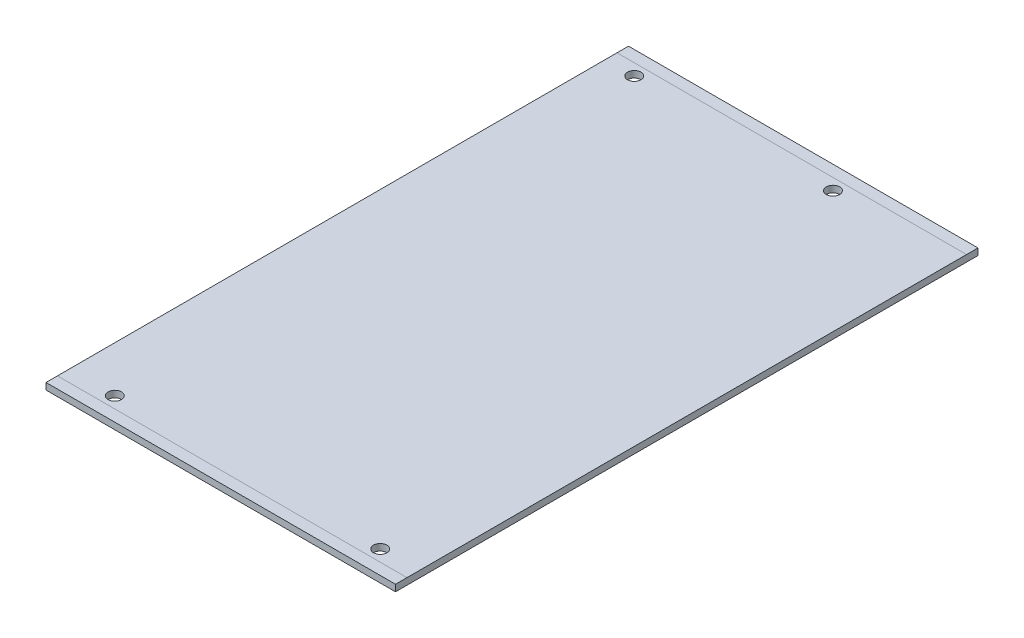
from build123d import *

# Parameters (mm, degrees)
SKETCH1_W           = 91.44
SKETCH1_H           = 152.4
BOSS_EXTRUDE1_DEPTH = 1.724
CUT_EXTRUDE1_REACH  = 90.88
SKETCH2_R           = 1.75
SKETCH3_W           = 91.44
SKETCH3_H           = 3
CUT_EXTRUDE2_DEPTH  = 0.0001


with BuildPart() as part:
    # Sketch1 → Boss-Extrude1 (new body)
    with BuildSketch(Plane(origin=(0, 0, 0), x_dir=(1, 0, 0), z_dir=(0, 1, 0))):
        Rectangle(SKETCH1_W, SKETCH1_H)
    extrude(amount=BOSS_EXTRUDE1_DEPTH)

    # Sketch2 → Cut-Extrude1 (cut, up to next)
    with BuildSketch(Plane(origin=(0, 1.724, 0), x_dir=(1, 0, 0), z_dir=(0, 1, 0)), mode=Mode.PRIVATE) as cut_extrude1_sk1:
        with Locations(Location((-38.22, 70.2, 0), (0, 0, 270))):
            Circle(SKETCH2_R)
    cut_extrude1_tool1 = extrude(cut_extrude1_sk1.sketch, amount=-CUT_EXTRUDE1_REACH, mode=Mode.PRIVATE) & part.part
    # Sketch2 → Cut-Extrude1 (cut, up to next)
    with BuildSketch(Plane(origin=(0, 1.724, 0), x_dir=(1, 0, 0), z_dir=(0, 1, 0)), mode=Mode.PRIVATE) as cut_extrude1_sk2:
        with Locations(Location((-33.72, -70.2, 0), (0, 0, 270))):
            Circle(SKETCH2_R)
    cut_extrude1_tool2 = extrude(cut_extrude1_sk2.sketch, amount=-CUT_EXTRUDE1_REACH, mode=Mode.PRIVATE) & part.part
    # Sketch2 → Cut-Extrude1 (cut, up to next)
    with BuildSketch(Plane(origin=(0, 1.724, 0), x_dir=(1, 0, 0), z_dir=(0, 1, 0)), mode=Mode.PRIVATE) as cut_extrude1_sk3:
        with Locations(Location((35.72, -70.2, 0), (0, 0, 270))):
            Circle(SKETCH2_R)
    cut_extrude1_tool3 = extrude(cut_extrude1_sk3.sketch, amount=-CUT_EXTRUDE1_REACH, mode=Mode.PRIVATE) & part.part
    # Sketch2 → Cut-Extrude1 (cut, up to next)
    with BuildSketch(Plane(origin=(0, 1.724, 0), x_dir=(1, 0, 0), z_dir=(0, 1, 0)), mode=Mode.PRIVATE) as cut_extrude1_sk4:
        with Locations(Location((13.78, 70.2, 0), (0, 0, 270))):
            Circle(SKETCH2_R)
    cut_extrude1_tool4 = extrude(cut_extrude1_sk4.sketch, amount=-CUT_EXTRUDE1_REACH, mode=Mode.PRIVATE) & part.part
    add(cut_extrude1_tool1.solids().sort_by_distance((-38.22, 1.724, -70.2))[0], mode=Mode.SUBTRACT)
    add(cut_extrude1_tool2.solids().sort_by_distance((-33.72, 1.724, 70.2))[0], mode=Mode.SUBTRACT)
    add(cut_extrude1_tool3.solids().sort_by_distance((35.72, 1.724, 70.2))[0], mode=Mode.SUBTRACT)
    add(cut_extrude1_tool4.solids().sort_by_distance((13.78, 1.724, -70.2))[0], mode=Mode.SUBTRACT)

    # Sketch3 → Cut-Extrude2 (cut)
    with BuildSketch(Plane(origin=(0, 1.724, 0), x_dir=(1, 0, 0), z_dir=(0, 1, 0))):
        with Locations((0, 74.7)):
            Rectangle(SKETCH3_W, SKETCH3_H)
        with Locations((0, -74.7)):
            Rectangle(SKETCH3_W, SKETCH3_H)
    extrude(amount=-CUT_EXTRUDE2_DEPTH, mode=Mode.SUBTRACT)


solid = part.part
